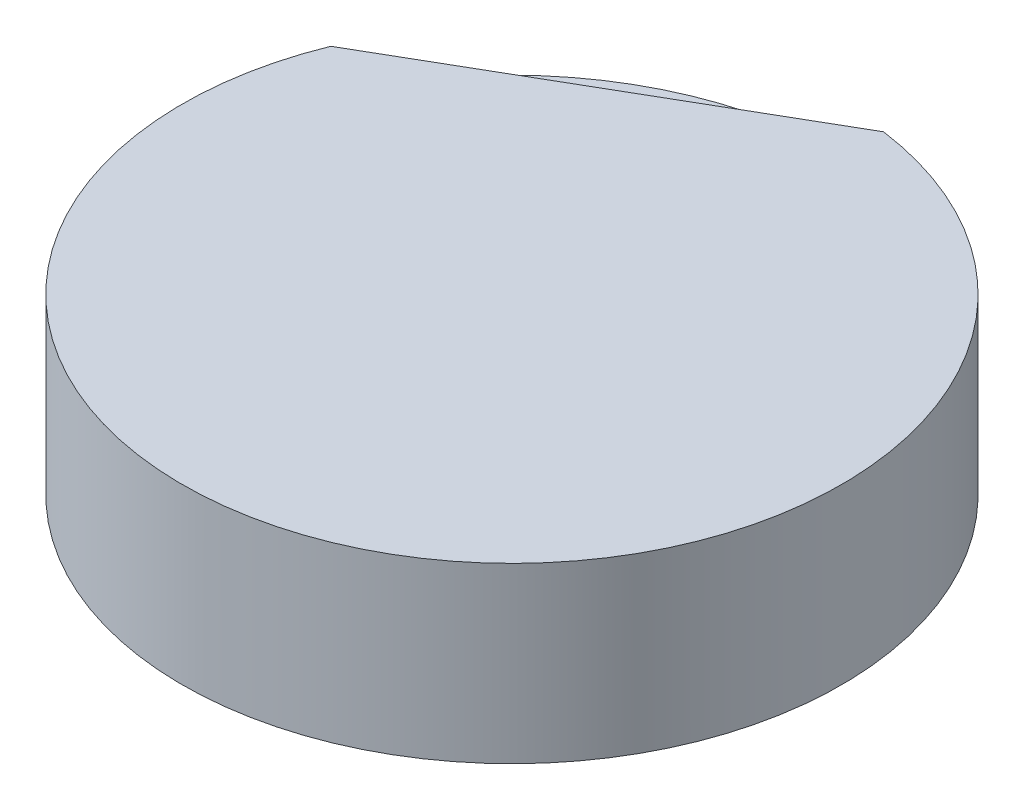
from build123d import *

# Parameters (mm, degrees)
KEYED_BACK_DEPTH   = 0.5
CUP_BLANK_SKETCH_R = 3.8
CUP_BLANK_DEPTH    = 1.5


with BuildPart() as part:
    # Keyed Back Sketch → Keyed Back (new body)
    with BuildSketch(Plane(origin=(0, -69, 0), x_dir=(-1, 0, 0), z_dir=(0, -1, 0))):
        with BuildLine():
            Line((74.811552234, 27.412647946), (70.771750258, 29.745028704))
            ThreePointArc((70.771750258, 29.745028704), (69.391651246, 22.689865579), (74.811552234, 27.412647946))
        make_face()
    extrude(amount=KEYED_BACK_DEPTH)

    # Cup Blank Sketch → Cup Blank (add)
    with BuildSketch(Plane(origin=(0, -69.5, 0), x_dir=(-1, 0, 0), z_dir=(0, -1, 0))):
        with Locations(Location((71.291651246, 25.980762114, 0), (0, 0, 22.136353638))):
            Circle(CUP_BLANK_SKETCH_R)
    extrude(amount=CUP_BLANK_DEPTH)

    # Spherical Bearing Seat profile → Spherical Bearing Seat (revolve, cut)
    with BuildSketch(Plane(origin=(0, -73, 0), x_dir=(-1, 0, 0), z_dir=(0, -1, 0))):
        with BuildLine():
            Line((71.291651246, 22.880762114), (71.291651246, 29.080762114))
            ThreePointArc((71.291651246, 29.080762114), (68.191651246, 25.980762114), (71.291651246, 22.880762114))
        make_face()
    revolve(axis=Axis((-71.291651246, -73, -35.980762114), (0, 0, 1)), mode=Mode.SUBTRACT)


solid = part.part
